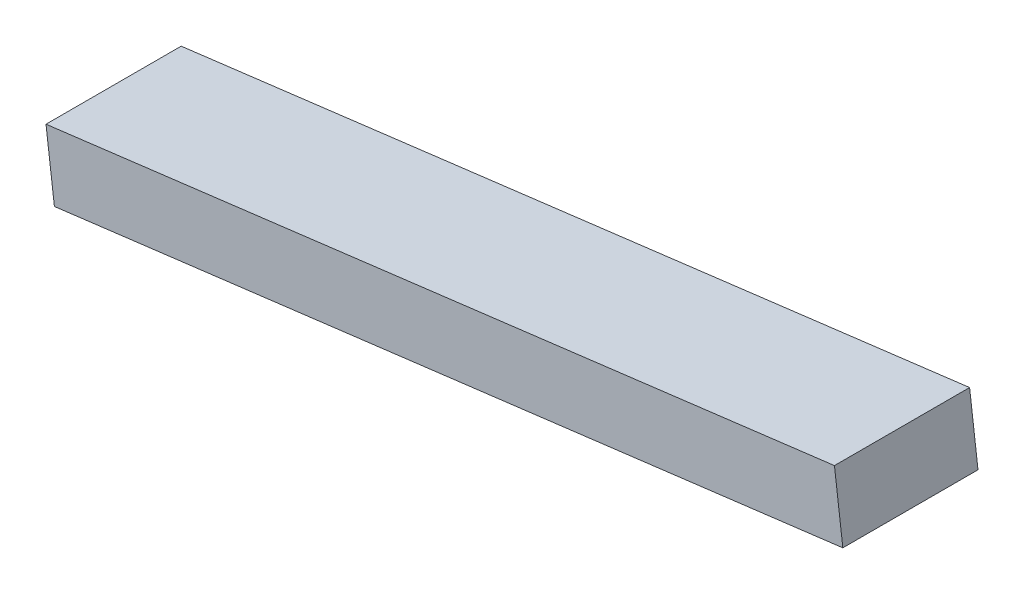
from build123d import *

# Parameters (mm, degrees)
BOSS_EXTRUDE1_DEPTH = 12.7
SKETCH2_W           = 1.016
SKETCH2_H           = 12.7
CUT_EXTRUDE1_DEPTH  = 748.288418958


with BuildPart() as part:
    # Sketch1 → Boss-Extrude1 (new body)
    with BuildSketch(Plane.XY.offset(-649.396489798)):
        Polygon((368.571015473, 25.827706843), (293.480518874, 16.438825445), (294.268351717, 10.137887467), (369.358848315, 19.526768865), align=None)
    extrude(amount=BOSS_EXTRUDE1_DEPTH)

    # Sketch2 → Cut-Extrude1 (cut, through all)
    with BuildSketch(Plane(origin=(3.281575038, -26.245416125, 0), x_dir=(0.9922736974441426, 0.12406816417006417, 0), z_dir=(0.12406816417006418, -0.9922736974441427, 0))):
        with Locations((368.419720466, -643.046489798)):
            Rectangle(SKETCH2_W, SKETCH2_H)
    extrude(amount=-CUT_EXTRUDE1_DEPTH, mode=Mode.SUBTRACT)


solid = part.part
